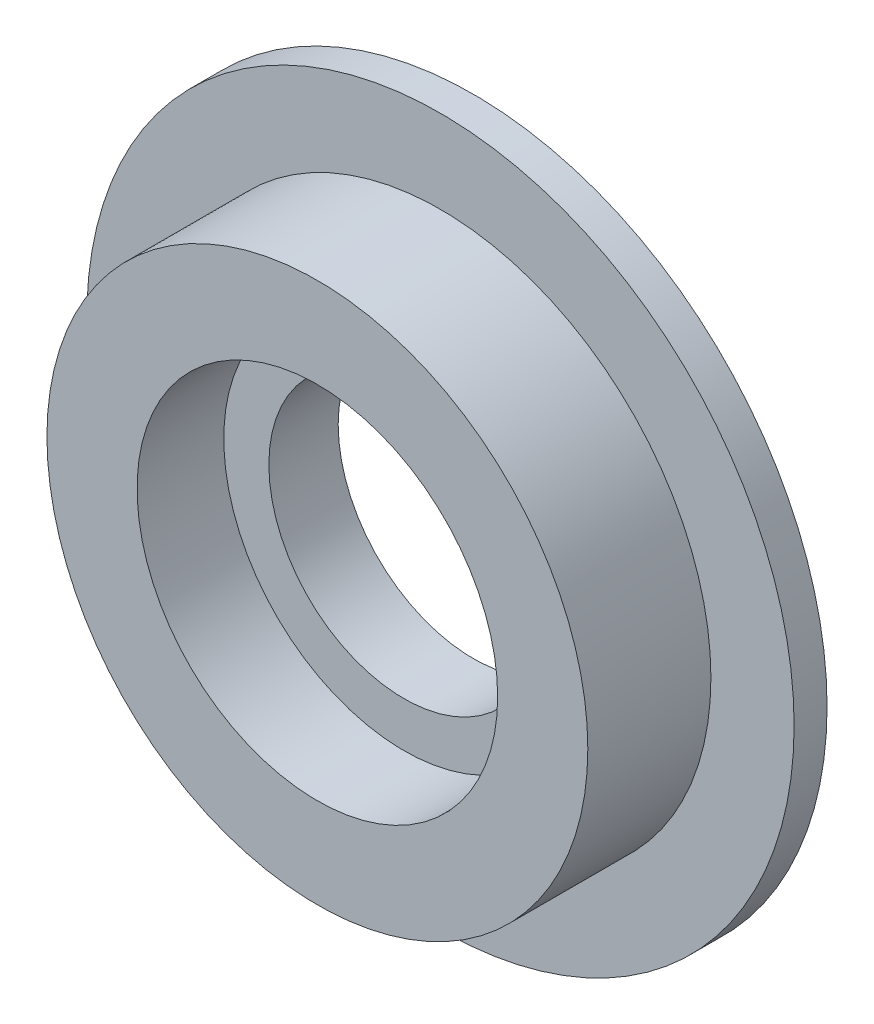
from build123d import *

# Parameters (mm, degrees)
SKETCH1_R           = 10.2
BOSS_EXTRUDE1_DEPTH = 0.95
SKETCH2_R           = 7.8
BOSS_EXTRUDE2_DEPTH = 3.55
SKETCH3_R           = 5.2
CUT_EXTRUDE1_DEPTH  = 2.5
SKETCH4_R           = 3.9
CUT_EXTRUDE2_DEPTH  = 16.110592311


with BuildPart() as part:
    # Sketch1 → Boss-Extrude1 (new body)
    with BuildSketch(Plane.XY.offset(0.95)):
        Circle(SKETCH1_R)
    extrude(amount=-BOSS_EXTRUDE1_DEPTH)

    # Sketch2 → Boss-Extrude2 (add)
    with BuildSketch(Plane.XY.offset(0.95)):
        with Locations(Location((0, 0, 0), (0, 0, 180))):
            Circle(SKETCH2_R)
    extrude(amount=BOSS_EXTRUDE2_DEPTH)

    # Sketch3 → Cut-Extrude1 (cut)
    with BuildSketch(Plane.XY.offset(4.5)):
        Circle(SKETCH3_R)
    extrude(amount=-CUT_EXTRUDE1_DEPTH, mode=Mode.SUBTRACT)

    # Sketch4 → Cut-Extrude2 (cut, through all)
    with BuildSketch(Plane(origin=(0, 0, 0), x_dir=(-1, 0, 0), z_dir=(0, 0, -1))):
        Circle(SKETCH4_R)
    extrude(amount=-CUT_EXTRUDE2_DEPTH, mode=Mode.SUBTRACT)


solid = part.part
